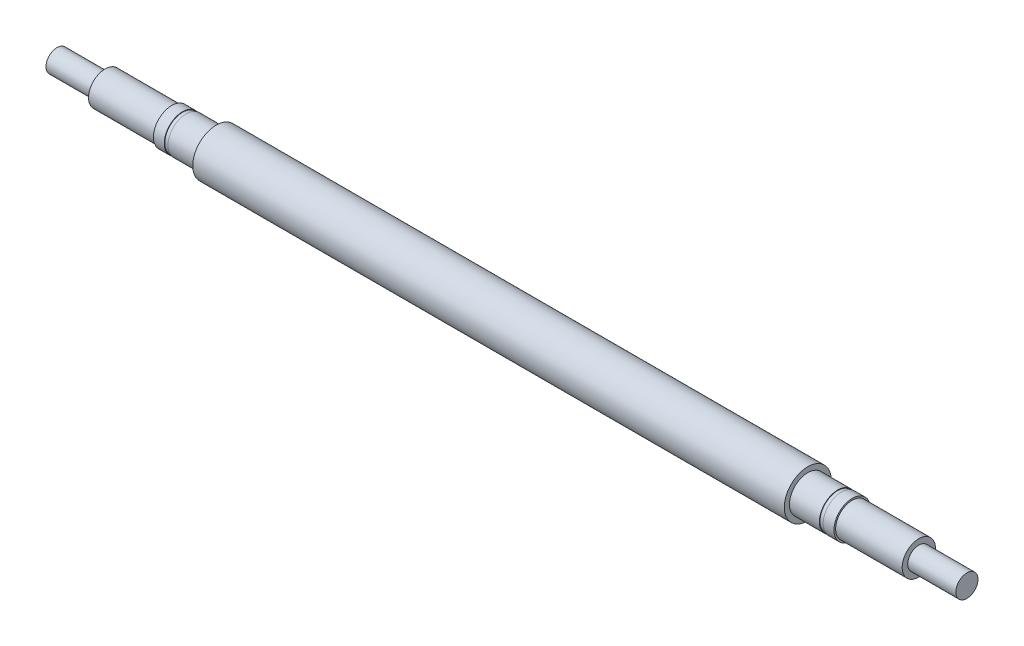
from build123d import *

# Parameters (mm, degrees)
CUT_EXTRUDE1_DEPTH      = 124.33016533
CUT_EXTRUDE1_DEPTH_BACK = 124.33016533


with BuildPart() as part:
    # Sketch1 → Revolve1 (revolve)
    with BuildSketch(Plane(origin=(0, 0, 0), x_dir=(1, 0, 0), z_dir=(0, 1, 0))):
        Polygon((123, 0.053684898), (-123, 0.053684898), (-123, 3.053684898), (-110, 3.053684898), (-110, 4.553684898), (-92, 4.553684898), (-92, 5.003684898), (-89.076146667, 5.003684898), (-89.076146667, 4.853684898), (-88.076146667, 4.853684898), (-88.076146667, 5.003684898), (-79.976146667, 5.003684898), (-79.976146667, 6.403684898), (79.976146667, 6.403684898), (79.976146667, 5.003684898), (88.076146667, 5.003684898), (88.076146667, 4.853684898), (89.076146667, 4.853684898), (89.076146667, 5.003684898), (92, 5.003684898), (92, 4.553684898), (110, 4.553684898), (110, 3.053684898), (123, 3.053684898), align=None)
    revolve(axis=Axis((123, 0, -0.053684898), (-1, 0, 0)))

    # Sketch5 → Cut-Extrude1 (cut, two sides: drawn at the far end of the back side and taken through both)
    with BuildSketch(Plane(origin=(0, 0, 0), x_dir=(1, 0, 0), z_dir=(0, 1, 0)).offset(-CUT_EXTRUDE1_DEPTH_BACK)):
        Polygon((-10.654863746, 304.833987592), (-10.654863746, 6.403684898), (-10.654863746, 5.35), (-20.654863746, 5.35), (-20.654863746, 6.403684898), (-20.654863746, 304.833987592), (-20.654863746, 901.69459298), (-10.654863746, 901.69459298), align=None)
    extrude(amount=CUT_EXTRUDE1_DEPTH + CUT_EXTRUDE1_DEPTH_BACK, mode=Mode.SUBTRACT)


solid = part.part
